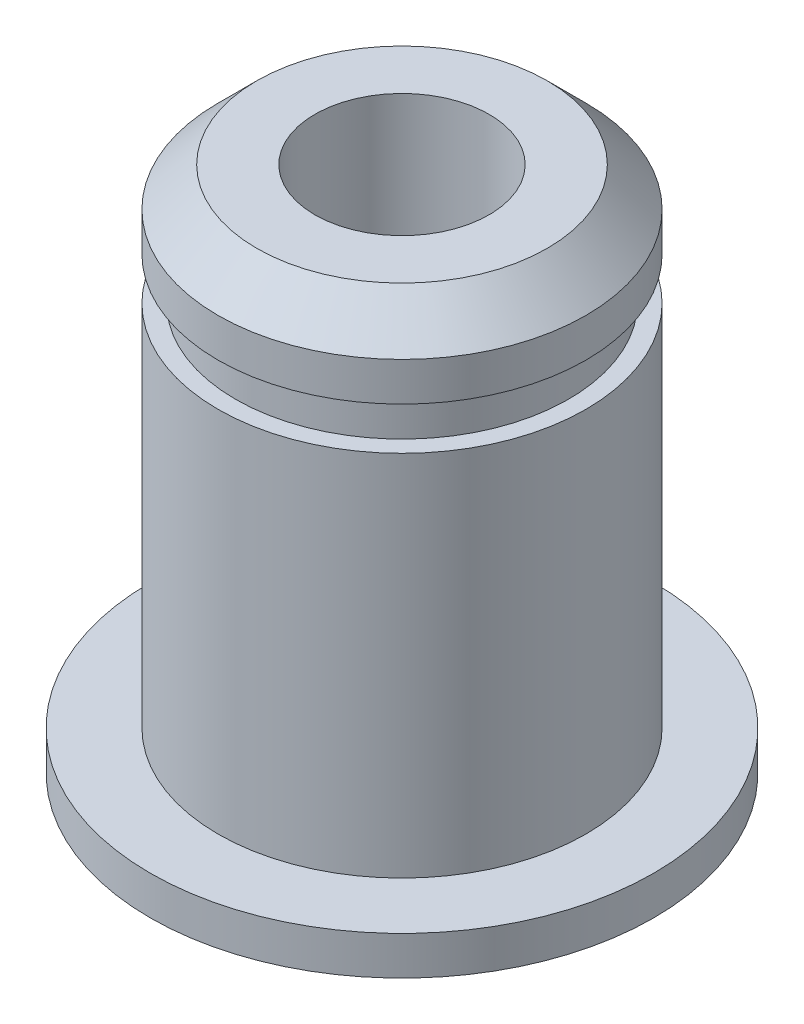
from build123d import *

# Parameters (mm, degrees)
CHAMFER1_SIZE = 1


with BuildPart() as part:
    # Sketch1 → Revolve1 (revolve)
    with BuildSketch(Plane.XY, mode=Mode.PRIVATE) as revolve1_sk:
        Polygon((2.25, 13.6), (2.25, 0), (6.5, 0), (6.5, 1), (4.75, 1), (4.75, 10.5), (4.3, 10.5), (4.3, 11.6), (4.75, 11.6), (4.75, 13.6), align=None)
    revolve(revolve1_sk.sketch.rotate(Axis((0, 13.6, 0), (0, -1, 0)), 90), axis=Axis((0, 13.6, 0), (0, -1, 0)))

    # Chamfer1
    chamfer1_edges = [part.edges().sort_by_distance(p)[0] for p in [
        (0, 13.6, -4.75),
    ]]
    chamfer(chamfer1_edges, length=CHAMFER1_SIZE)


solid = part.part
